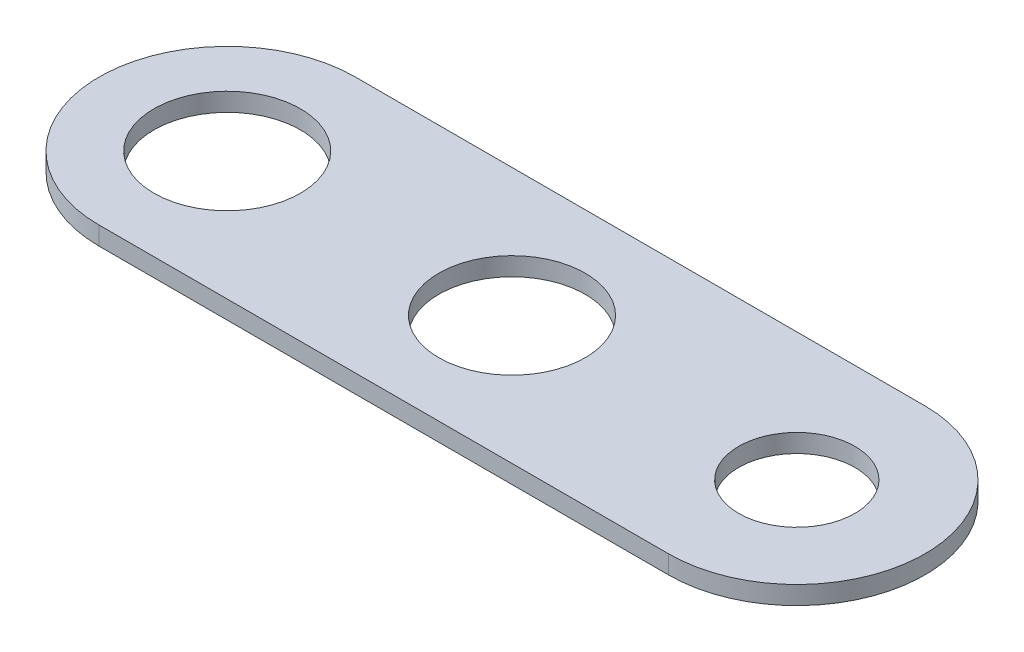
from build123d import *

# Parameters (mm, degrees)
SKETCH1_R           = 4
SKETCH1_R_2         = 3.175
BOSS_EXTRUDE1_DEPTH = 1


with BuildPart() as part:
    # Sketch1 → Boss-Extrude1 (new body)
    with BuildSketch(Plane(origin=(0, 0, 0), x_dir=(1, 0, 0), z_dir=(0, 1, 0))):
        with BuildLine():
            Line((-15.555, 7), (15.555, 7))
            ThreePointArc((15.555, 7), (22.555, 0), (15.555, -7))
            Line((15.555, -7), (-15.555, -7))
            ThreePointArc((-15.555, -7), (-22.555, 0), (-15.555, 7))
        make_face()
        with Locations(Location((-15.555, 0, 0), (0, 0, 270))):
            Circle(SKETCH1_R, mode=Mode.SUBTRACT)
        with Locations(Location((0, 0, 0), (0, 0, 270))):
            Circle(SKETCH1_R, mode=Mode.SUBTRACT)
        with Locations(Location((15.555, 0, 0), (0, 0, 270))):
            Circle(SKETCH1_R_2, mode=Mode.SUBTRACT)
    extrude(amount=BOSS_EXTRUDE1_DEPTH)


solid = part.part
